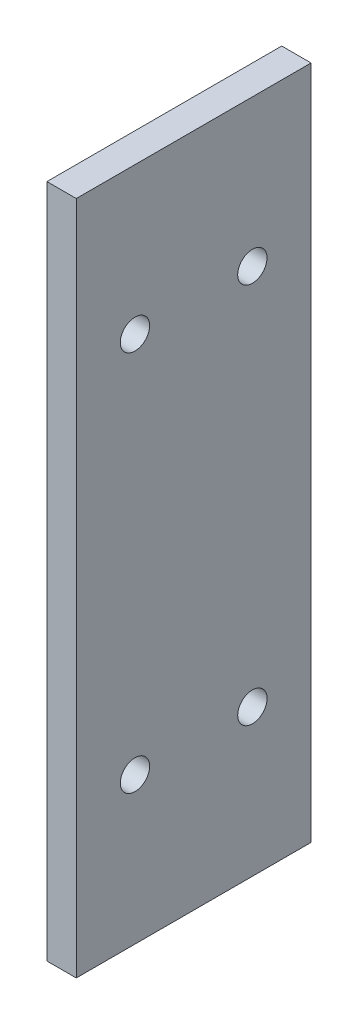
from build123d import *

# Parameters (mm, degrees)
SKETCH1_W           = 115
SKETCH1_H           = 40
SKETCH1_R           = 2.5
BOSS_EXTRUDE1_DEPTH = 5


with BuildPart() as part:
    # Sketch1 → Boss-Extrude1 (new body)
    with BuildSketch(Plane.YZ):
        Rectangle(SKETCH1_W, SKETCH1_H)
        with Locations(Location((-32.5, 10, 0), (0, 0, 270))):
            Circle(SKETCH1_R, mode=Mode.SUBTRACT)
        with Locations(Location((32.5, 10, 0), (0, 0, 90))):
            Circle(SKETCH1_R, mode=Mode.SUBTRACT)
        with Locations(Location((32.5, -10, 0), (0, 0, 270))):
            Circle(SKETCH1_R, mode=Mode.SUBTRACT)
        with Locations(Location((-32.5, -10, 0), (0, 0, 90))):
            Circle(SKETCH1_R, mode=Mode.SUBTRACT)
    extrude(amount=BOSS_EXTRUDE1_DEPTH)


solid = part.part
